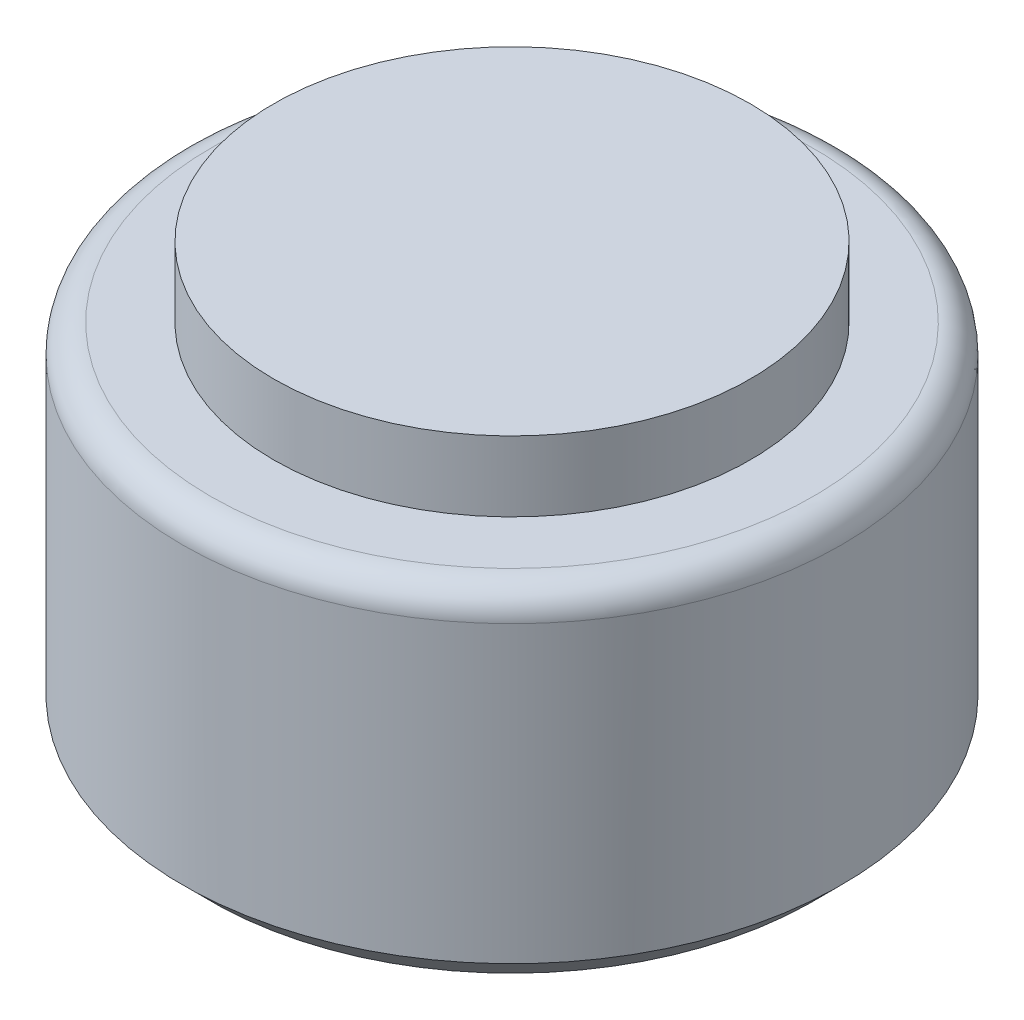
from build123d import *

# Parameters (mm, degrees)
HOLE_WIZARD_M16_1_D     = 14
HOLE_WIZARD_M16_1_DEPTH = 38
HOLE_WIZARD_M16_1_TIP   = 4.206024333
CHAMFER_1_SIZE          = 10
FILLET_1_R              = 10


with BuildPart() as part:
    # 草图1 → 旋转1 (revolve)
    with BuildSketch(Plane.XY, mode=Mode.PRIVATE) as revolve_1_sk:
        Polygon((0, 0), (85, 0), (85, -25), (117.5, -25), (117.5, -150), (67.5, -150), (67.5, -110), (0, -110), align=None)
    revolve(revolve_1_sk.sketch.rotate(Axis((0, 0, 0), (0, 1, 0)), 90), axis=Axis((0, 0, 0), (0, 1, 0)))

    # M16 螺纹孔1
    with Locations(Plane(origin=(0, -110, 0), x_dir=(-1, 0, 0), z_dir=(0, -1, 0))):
        with Locations((0, 0)):
            Hole(HOLE_WIZARD_M16_1_D / 2, depth=HOLE_WIZARD_M16_1_DEPTH)
            with Locations((0, 0, -(HOLE_WIZARD_M16_1_DEPTH + HOLE_WIZARD_M16_1_TIP / 2))):  # 118° drill point
                Cone(0, HOLE_WIZARD_M16_1_D / 2, HOLE_WIZARD_M16_1_TIP, mode=Mode.SUBTRACT)

    # 倒角1
    chamfer_1_edges = [part.edges().sort_by_distance(p)[0] for p in [
        (0, -150, 117.5),
    ]]
    chamfer(chamfer_1_edges, length=CHAMFER_1_SIZE)

    # 圆角1
    fillet_1_edges = [part.edges().sort_by_distance(p)[0] for p in [
        (0, -25, 117.5),
    ]]
    fillet(fillet_1_edges, radius=FILLET_1_R)


solid = part.part
